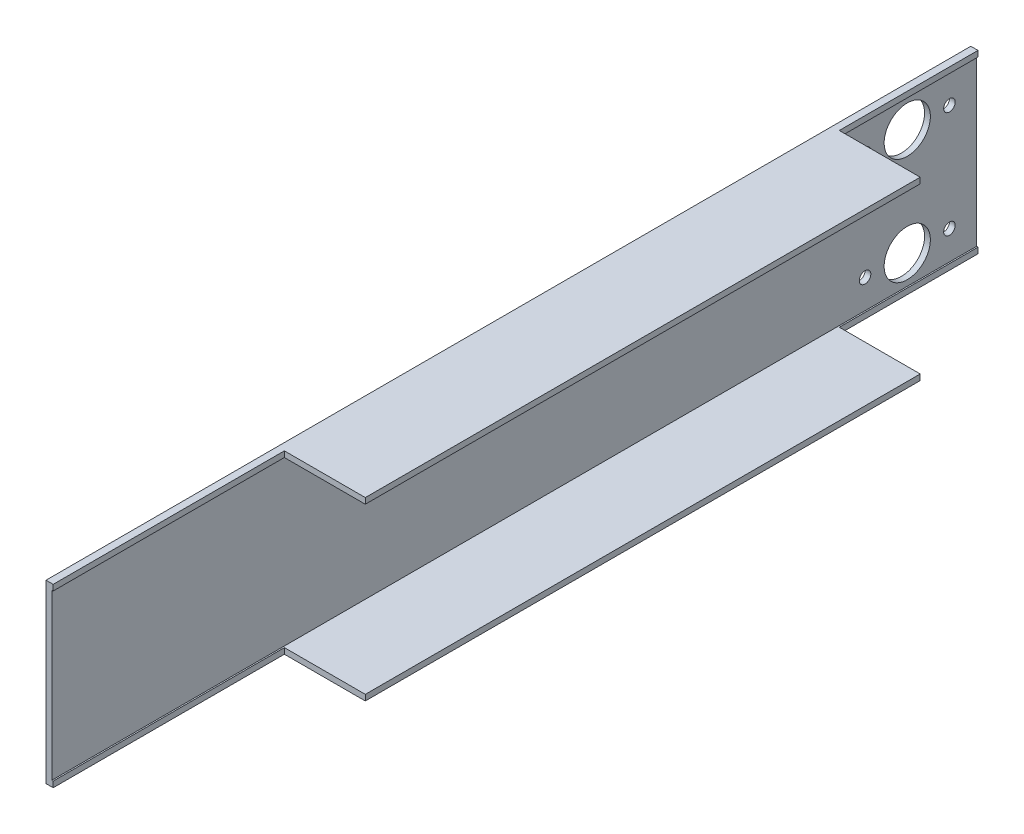
from build123d import *

# Parameters (mm, degrees)
RESSALTO_EXTRUS_O1_DEPTH = 400
ESBO_O3_R                = 10
ESBO_O3_R_2              = 2.5
CORTE_EXTRUS_O1_DEPTH    = 409.971942803
ESBO_O4_W                = 35
ESBO_O4_H                = 60
ESBO_O4_H_2              = 100
CORTE_EXTRUS_O2_DEPTH    = 409.971942803


with BuildPart() as part:
    # Esboço2 → Ressalto-extrusão1 (new body)
    with BuildSketch(Plane.XY):
        Polygon((0, 0), (0, 76.2), (38.1, 76.2), (38.1, 73.7), (2.5, 73.7), (2.5, 2.5), (38.1, 2.5), (38.1, 0), align=None)
    extrude(amount=RESSALTO_EXTRUS_O1_DEPTH)

    # Esboço3 → Corte-extrusão1 (cut, through all)
    with BuildSketch(Plane.ZY):
        with Locations((30, 15)):
            Circle(ESBO_O3_R)
        with Locations((30, 61.2)):
            Circle(ESBO_O3_R)
        with Locations((11.75, 15)):
            Circle(ESBO_O3_R_2)
        with Locations((48.25, 15)):
            Circle(ESBO_O3_R_2)
        with Locations((48.25, 61.2)):
            Circle(ESBO_O3_R_2)
        with Locations((11.75, 61.2)):
            Circle(ESBO_O3_R_2)
    extrude(amount=-CORTE_EXTRUS_O1_DEPTH, mode=Mode.SUBTRACT)

    # Esboço4 → Corte-extrusão2 (cut, through all)
    with BuildSketch(Plane.XZ):
        with Locations((20.6, 30)):
            Rectangle(ESBO_O4_W, ESBO_O4_H)
        with Locations((20.6, 350)):
            Rectangle(ESBO_O4_W, ESBO_O4_H_2)
    extrude(amount=-CORTE_EXTRUS_O2_DEPTH, mode=Mode.SUBTRACT)


solid = part.part
